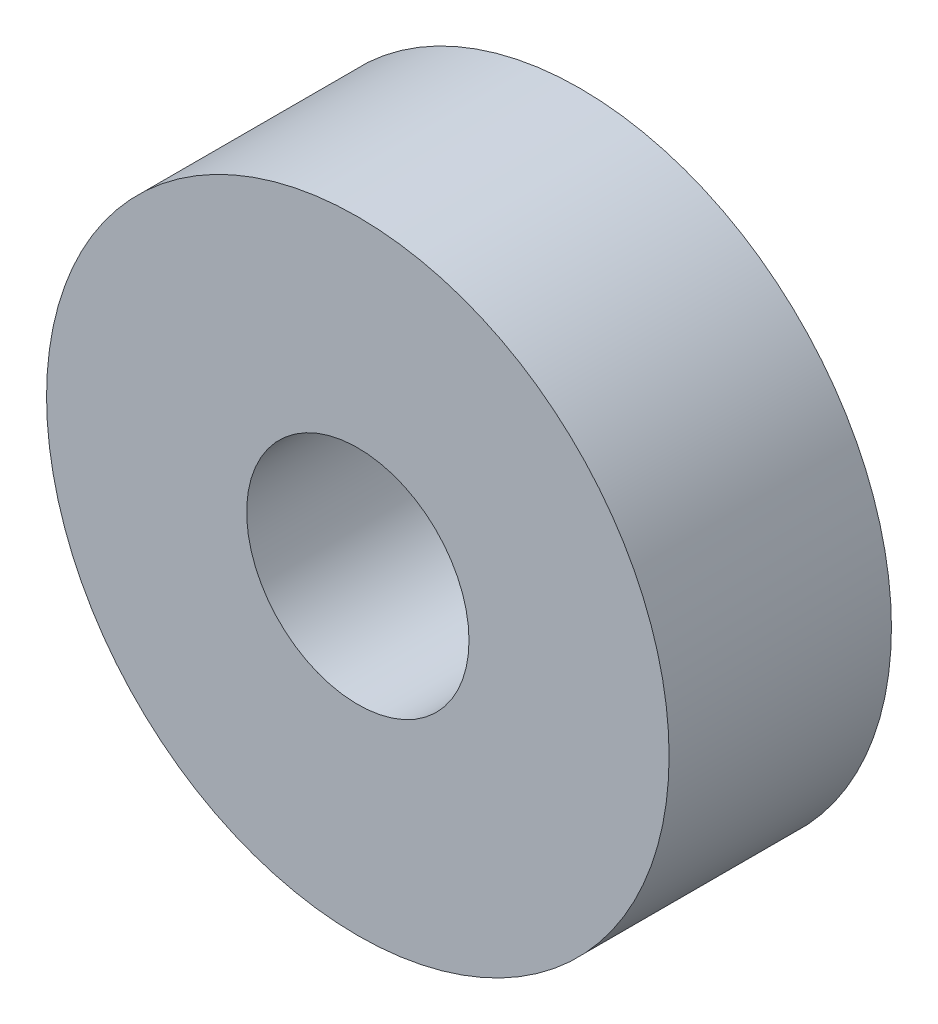
from build123d import *

# Parameters (mm, degrees)
SKETCH_1_R      = 7
SKETCH_1_R_2    = 2.5
EXTRUDE_1_DEPTH = 5


with BuildPart() as part:
    # Эскиз1 → Бобышка-Вытянуть1 (new body)
    with BuildSketch(Plane.XY):
        Circle(SKETCH_1_R)
        Circle(SKETCH_1_R_2, mode=Mode.SUBTRACT)
    extrude(amount=EXTRUDE_1_DEPTH)


solid = part.part
